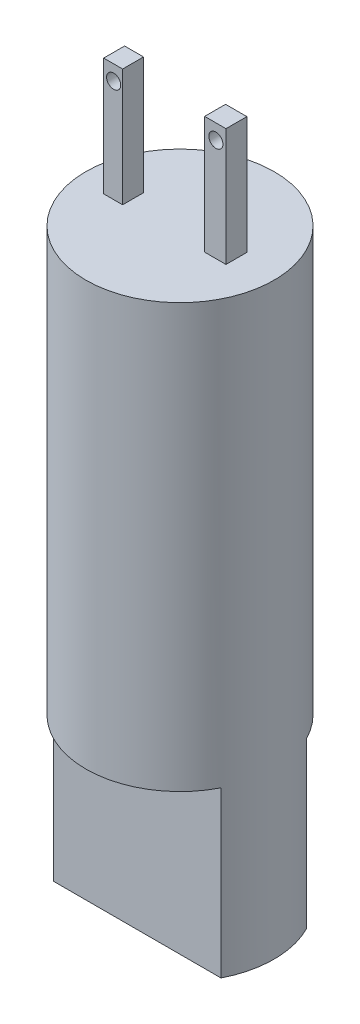
from build123d import *

# Parameters (mm, degrees)
SKETCH2_R           = 4
BOSS_EXTRUDE1_DEPTH = 25
CUT_EXTRUDE1_DEPTH  = 7
SKETCH6_W           = 0.80480735
SKETCH6_H           = 0.88864145
SKETCH6_W_2         = 0.905408268
BOSS_EXTRUDE2_DEPTH = 5
SKETCH7_R           = 0.3
CUT_EXTRUDE2_DEPTH  = 5


with BuildPart() as part:
    # Sketch2 → Boss-Extrude1 (new body)
    with BuildSketch(Plane(origin=(0, 0, 0), x_dir=(1, 0, 0), z_dir=(0, 1, 0))):
        with Locations(Location((0, 0, 0), (0, 0, 270))):
            Circle(SKETCH2_R)
    extrude(amount=BOSS_EXTRUDE1_DEPTH)

    # Sketch3 → Cut-Extrude1 (cut)
    with BuildSketch(Plane.XZ):
        with BuildLine():
            Line((-4.426440425, 1.819199948), (4.426440425, 1.819199948))
            ThreePointArc((4.426440425, 1.819199948), (0, 4.216961573), (-4.426440425, 1.819199948))
        make_face()
        with BuildLine():
            Line((-4.426440425, -1.819199948), (4.426440425, -1.819199948))
            ThreePointArc((4.426440425, -1.819199948), (0, -4.323632304), (-4.426440425, -1.819199948))
        make_face()
    extrude(amount=-CUT_EXTRUDE1_DEPTH, mode=Mode.SUBTRACT)

    # Sketch6 → Boss-Extrude2 (add)
    with BuildSketch(Plane(origin=(0, 25, 0), x_dir=(1, 0, 0), z_dir=(0, 1, 0))):
        with Locations((-2.39765523, 0)):
            Rectangle(SKETCH6_W, SKETCH6_H)
        with Locations((1.944951096, 0)):
            Rectangle(SKETCH6_W_2, SKETCH6_H)
    extrude(amount=BOSS_EXTRUDE2_DEPTH)

    # Sketch7 → Cut-Extrude2 (cut)
    with BuildSketch(Plane(origin=(0, 0, -0.444320725), x_dir=(-1, 0, 0), z_dir=(0, 0, -1))):
        with Locations((-1.968156059, 29.360387354)):
            Circle(SKETCH7_R)
        with Locations((2.377573757, 29.360387354)):
            Circle(SKETCH7_R)
    extrude(amount=-CUT_EXTRUDE2_DEPTH, mode=Mode.SUBTRACT)


solid = part.part
